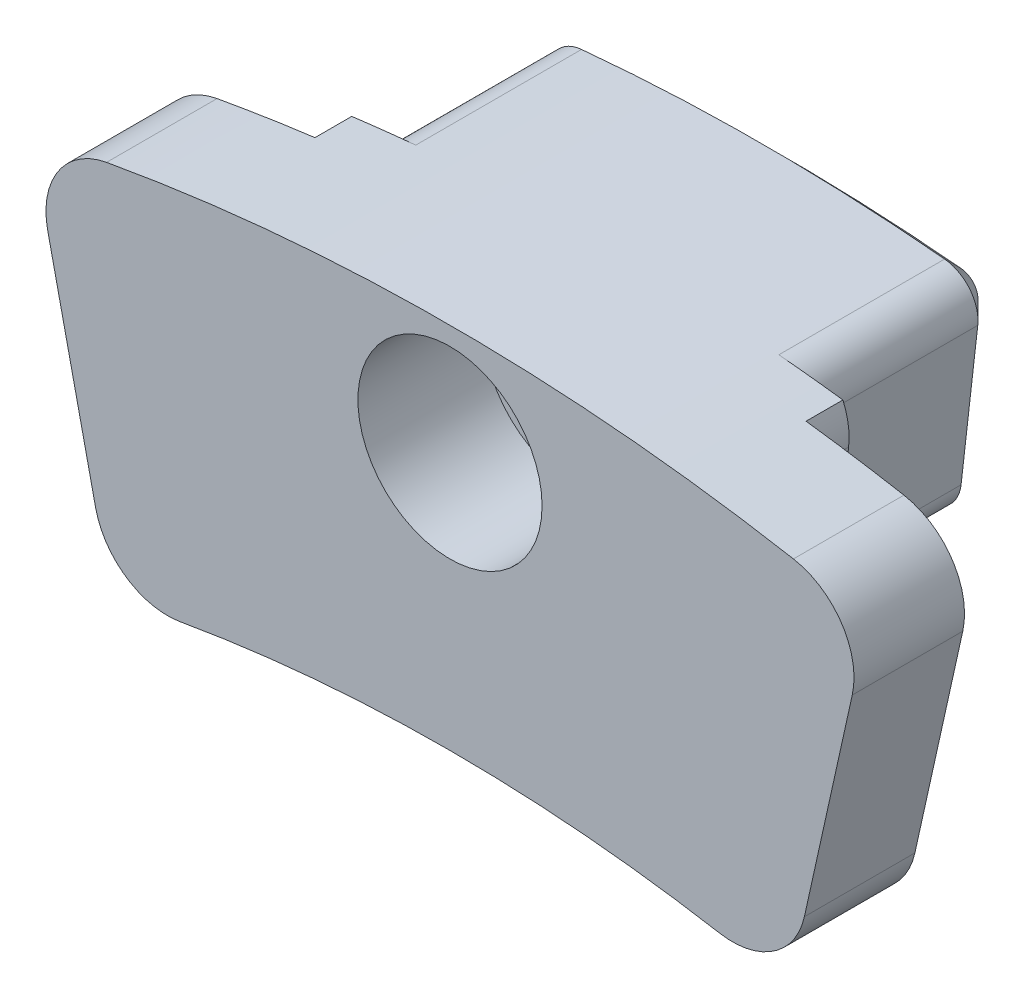
from build123d import *

# Parameters (mm, degrees)
EXTRUDE_1_DEPTH           = 6
FILLET_1_R                = 1
EXTRUDE_2_DEPTH           = 3
FILLET_2_R                = 2
HOLE_WIZARD_1_D           = 3.4
HOLE_WIZARD_1_CBORE_D     = 5
HOLE_WIZARD_1_CBORE_DEPTH = 3.4
EXTRUDE_3_DEPTH           = 1
CHAMFER_1_SIZE            = 0.5


with BuildPart() as part:
    # 草图1 → 凸台-拉伸1 (new body)
    with BuildSketch(Plane.XY):
        with BuildLine():
            Line((-5.26394944, 46.201091289), (-5.943168723, 52.162522423))
            ThreePointArc((-5.943168723, 52.162522423), (0, 52.5), (5.943168723, 52.162522423))
            Line((5.943168723, 52.162522423), (5.26394944, 46.201091289))
            ThreePointArc((5.26394944, 46.201091289), (0, 46.5), (-5.26394944, 46.201091289))
        make_face()
    extrude(amount=EXTRUDE_1_DEPTH)

    # 圆角1
    fillet_1_edges = [part.edges().sort_by_distance(p)[0] for p in [
        (5.943168723, 52.162522423, 3),
        (5.26394944, 46.201091289, 3),
        (-5.26394944, 46.201091289, 3),
        (-5.943168723, 52.162522423, 3),
    ]]
    fillet(fillet_1_edges, radius=FILLET_1_R)

    # 草图2 → 凸台-拉伸2 (add)
    with BuildSketch(Plane.XY.offset(6)):
        with BuildLine():
            Line((-9.198683592, 41.492580303), (-11.363079732, 51.255540374))
            ThreePointArc((-11.363079732, 51.255540374), (0, 52.5), (11.363079732, 51.255540374))
            Line((11.363079732, 51.255540374), (9.198683592, 41.492580303))
            ThreePointArc((9.198683592, 41.492580303), (0, 42.5), (-9.198683592, 41.492580303))
        make_face()
    extrude(amount=EXTRUDE_2_DEPTH)

    # 圆角2
    fillet_2_edges = [part.edges().sort_by_distance(p)[0] for p in [
        (11.363079732, 51.255540374, 7.5),
        (-11.363079732, 51.255540374, 7.5),
        (-9.198683592, 41.492580303, 7.5),
        (9.198683592, 41.492580303, 7.5),
    ]]
    fillet(fillet_2_edges, radius=FILLET_2_R)

    # 打孔尺寸(%根据)内六角圆柱头螺钉的类型1 (through all)
    with Locations(Plane.XY.offset(9)):
        with Locations((0, 49.5)):
            CounterBoreHole(HOLE_WIZARD_1_D / 2, HOLE_WIZARD_1_CBORE_D / 2, HOLE_WIZARD_1_CBORE_DEPTH)

    # 草图6 → 凸台-拉伸3 (add)
    with BuildSketch(Plane(origin=(0, 0, 6), x_dir=(-1, 0, 0), z_dir=(0, 0, -1))):
        with BuildLine():
            Line((-6.822438201, 51.046100115), (-6.369532765, 47.071000121))
            ThreePointArc((-6.369532765, 47.071000121), (-5.643826215, 45.74538326), (-4.197867409, 45.305936799))
            ThreePointArc((-4.197867409, 45.305936799), (0, 45.5), (4.197867409, 45.305936799))
            ThreePointArc((4.197867409, 45.305936799), (5.643826215, 45.74538326), (6.369532765, 47.071000121))
            Line((6.369532765, 47.071000121), (6.822438201, 51.046100115))
            ThreePointArc((6.822438201, 51.046100115), (6.812927902, 51.570778372), (6.667268559, 52.074922275))
            ThreePointArc((6.667268559, 52.074922275), (5.799030491, 52.178743233), (4.929183703, 52.268089194))
            ThreePointArc((4.929183703, 52.268089194), (5.611821641, 51.902590333), (5.828866345, 51.159303329))
            Line((5.828866345, 51.159303329), (5.375960909, 47.184203334))
            ThreePointArc((5.375960909, 47.184203334), (5.013107634, 46.521394904), (4.290128231, 46.301671673))
            ThreePointArc((4.290128231, 46.301671673), (0, 46.5), (-4.290128231, 46.301671673))
            ThreePointArc((-4.290128231, 46.301671673), (-5.013107634, 46.521394904), (-5.375960909, 47.184203334))
            Line((-5.375960909, 47.184203334), (-5.828866345, 51.159303329))
            ThreePointArc((-5.828866345, 51.159303329), (-5.611821641, 51.902590333), (-4.929183703, 52.268089194))
            ThreePointArc((-4.929183703, 52.268089194), (-5.799030491, 52.178743233), (-6.667268559, 52.074922275))
            ThreePointArc((-6.667268559, 52.074922275), (-6.812927902, 51.570778372), (-6.822438201, 51.046100115))
        make_face()
    extrude(amount=EXTRUDE_3_DEPTH)

    # 倒角1
    chamfer_1_edges = [part.edges().sort_by_distance(p)[0] for p in [
        (0, 46.5, 0),
        (0, 52.5, 0),
        (5.602413627, 49.171753332, 0),
        (-5.602413627, 49.171753332, 0),
        (-5.611821641, 51.902590333, 0),
        (5.611821641, 51.902590333, 0),
        (5.013107634, 46.521394904, 0),
        (-5.013107634, 46.521394904, 0),
    ]]
    chamfer(chamfer_1_edges, length=CHAMFER_1_SIZE)


solid = part.part
